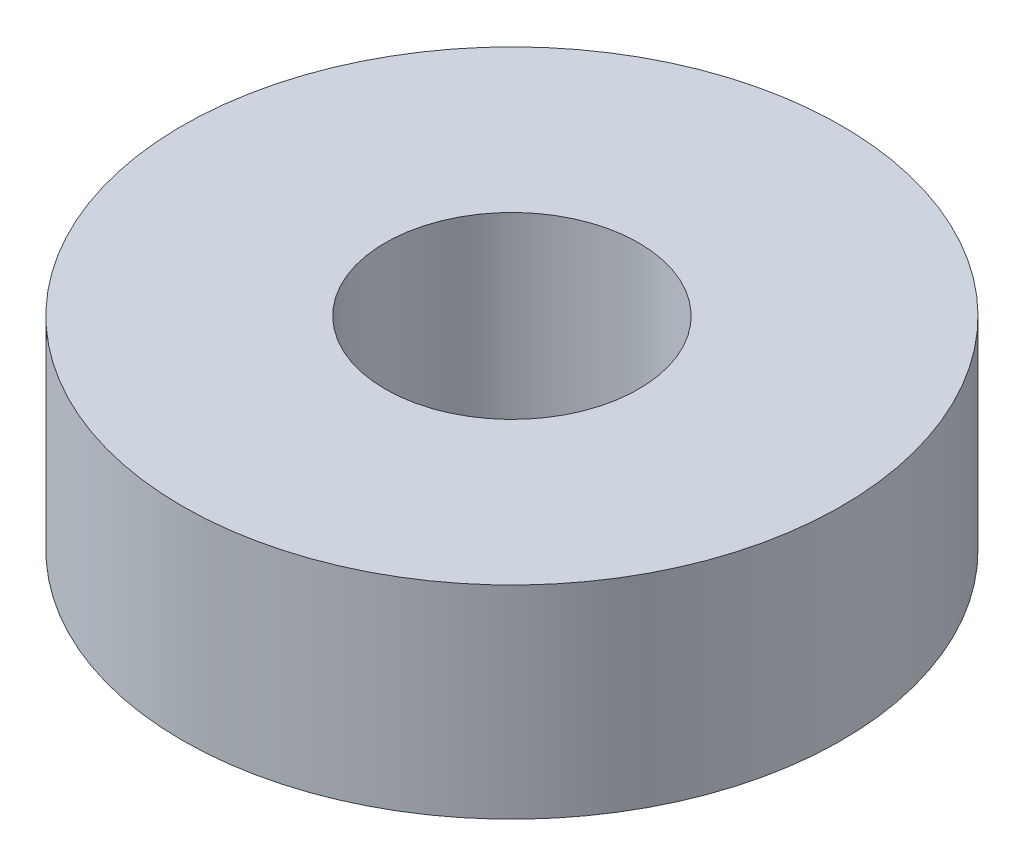
from build123d import *

# Parameters (mm, degrees)
SKETCH1_R           = 6.5
SKETCH1_R_2         = 2.5
BOSS_EXTRUDE1_DEPTH = 4


with BuildPart() as part:
    # Sketch1 → Boss-Extrude1 (new body)
    with BuildSketch(Plane(origin=(0, 0, 0), x_dir=(1, 0, 0), z_dir=(0, 1, 0))):
        with Locations(Location((0, 0, 0), (0, 0, 270))):
            Circle(SKETCH1_R)
        with Locations(Location((0, 0, 0), (0, 0, 270))):
            Circle(SKETCH1_R_2, mode=Mode.SUBTRACT)
    extrude(amount=BOSS_EXTRUDE1_DEPTH)


solid = part.part
